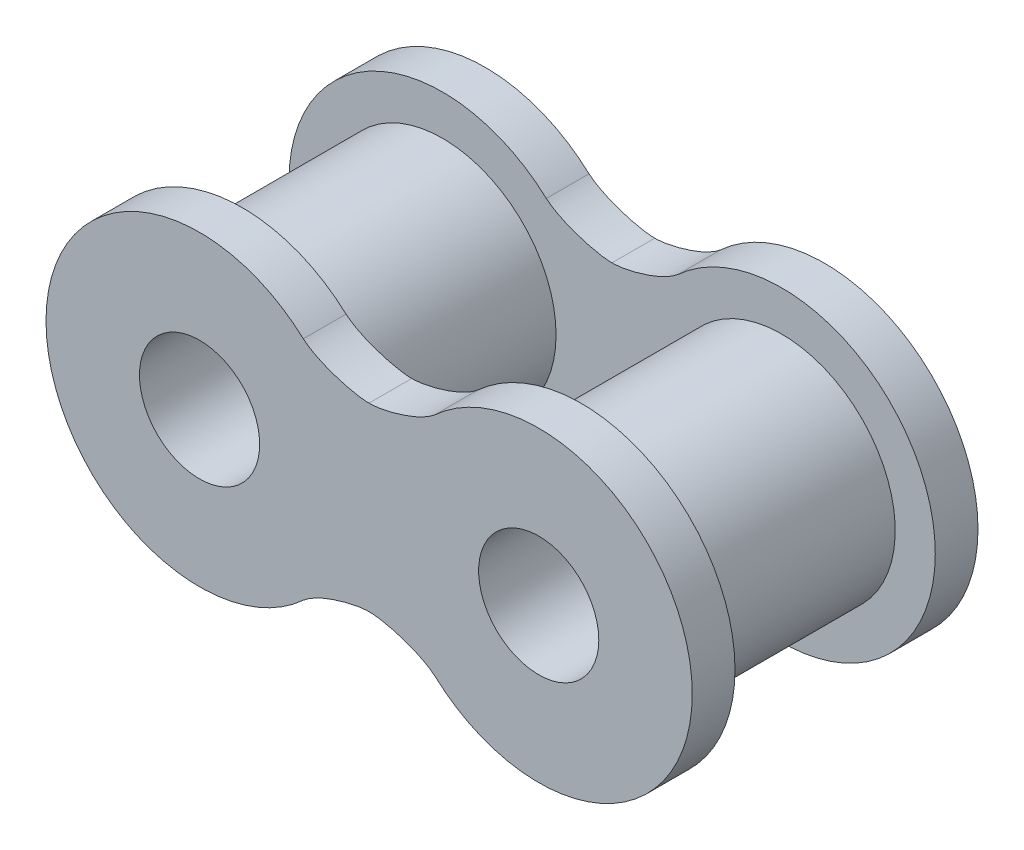
from build123d import *

# Parameters (mm, degrees)
SKETCH_1_R        = 4.25
SKETCH_1_R_2      = 2.25
EXTRUDE_1_DEPTH   = 3.75
EXTRUDE_1_2_DEPTH = 3.75
SKETCH_2_R        = 5.75
SKETCH_2_R_2      = 4.25
SKETCH_2_R_3      = 2.25
EXTRUDE_3_DEPTH   = 1.6


with BuildPart() as part:
    # 草图1 → 凸台-拉伸1 (new body)
    with BuildSketch(Plane.XY):
        with Locations((-6.35, 0)):
            Circle(SKETCH_1_R)
        with Locations((-6.35, 0)):
            Circle(SKETCH_1_R_2, mode=Mode.SUBTRACT)
    extrude_1 = extrude(amount=EXTRUDE_1_DEPTH)



with BuildPart() as body_2:
    # 草图1 → Extrude 1 2 (new body)
    with BuildSketch(Plane.XY):
        with Locations(Location((6.35, 0, 0), (0, 0, 180))):
            Circle(SKETCH_1_R)
        with Locations(Location((6.35, 0, 0), (0, 0, 180))):
            Circle(SKETCH_1_R_2, mode=Mode.SUBTRACT)
    extrude_1_2 = extrude(amount=EXTRUDE_1_2_DEPTH)


with BuildPart() as part_1:
    add(part.part)

    add(body_2.part)  # 凸台-拉伸3 merges body 2
    # 草图2 → 凸台-拉伸3 (add)
    # profile 1 of 4: a face of its own
    with BuildSketch(Plane.XY.offset(3.75)):
        with Locations((-6.35, 0)):
            Circle(SKETCH_2_R)
        with Locations((-6.35, 0)):
            Circle(SKETCH_2_R_2, mode=Mode.SUBTRACT)
    # profile 2 of 4: a face of its own
    with BuildSketch(Plane.XY.offset(3.75)):
        with Locations((-6.35, 0)):
            Circle(SKETCH_2_R_2)
        with Locations((-6.35, 0)):
            Circle(SKETCH_2_R_3, mode=Mode.SUBTRACT)
    # profile 3 of 4: a face of its own
    with BuildSketch(Plane.XY.offset(3.75)):
        with BuildLine():
            ThreePointArc((-2.464522189, 4.238580208), (-1.086731177, 2.315275641), (-0.6, 0))
            ThreePointArc((-0.6, 0), (-1.086731177, -2.315275641), (-2.464522189, -4.238580208))
            add(Edge.make_bspline(
                [(-2.464522189, -4.238580208), (-1.801147303, -3.67793909), (-0.370790644, -3.34588107), (0, -3.386350938)],
                knots=[0, 0, 0, 0, 1, 1, 1, 1], degree=3))
            add(Edge.make_bspline(
                [(2.464522189, -4.238580208), (1.801147303, -3.67793909), (0.370790644, -3.34588107), (0, -3.386350938)],
                knots=[0, 0, 0, 0, 1, 1, 1, 1], degree=3))
            ThreePointArc((2.464522189, -4.238580208), (0.6, 0), (2.464522189, 4.238580208))
            add(Edge.make_bspline(
                [(2.464522189, 4.238580208), (1.801147303, 3.67793909), (0.370790644, 3.34588107), (0, 3.386350938)],
                knots=[0, 0, 0, 0, 1, 1, 1, 1], degree=3))
            add(Edge.make_bspline(
                [(-2.464522189, 4.238580208), (-1.801147303, 3.67793909), (-0.370790644, 3.34588107), (0, 3.386350938)],
                knots=[0, 0, 0, 0, 1, 1, 1, 1], degree=3))
        make_face()
    # profile 4 of 4: a face of its own
    with BuildSketch(Plane.XY.offset(3.75)):
        with Locations((6.35, 0)):
            Circle(SKETCH_2_R)
        with Locations(Location((6.35, 0, 0), (0, 0, 180))):
            Circle(SKETCH_2_R_3, mode=Mode.SUBTRACT)
    extrude_3 = extrude(amount=EXTRUDE_3_DEPTH)

    # 镜向2: 凸台-拉伸1, Extrude 1 2, 凸台-拉伸3 across plane
    add(extrude_1.mirror(Plane(origin=(0, 0, 0), x_dir=(1, 0, 0), z_dir=(0, 0, -1))))
    add(extrude_1_2.mirror(Plane(origin=(0, 0, 0), x_dir=(1, 0, 0), z_dir=(0, 0, -1))))
    add(extrude_3.mirror(Plane(origin=(0, 0, 0), x_dir=(1, 0, 0), z_dir=(0, 0, -1))))


solid = part_1.part
